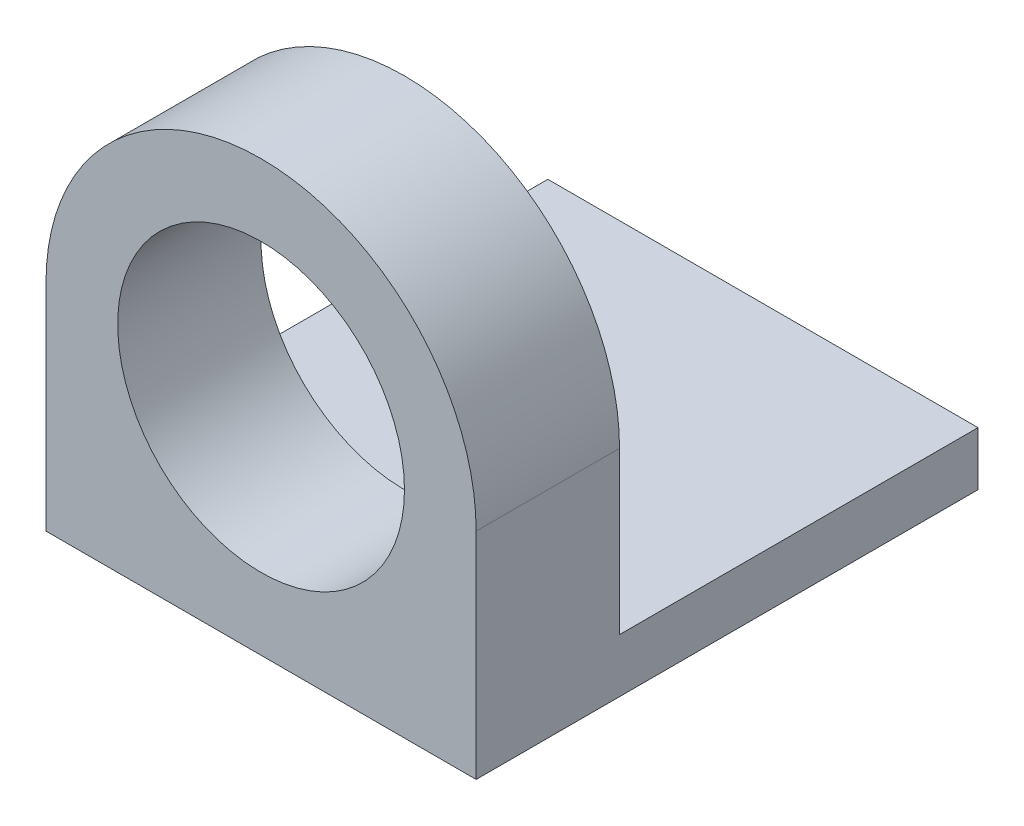
from build123d import *

# Parameters (mm, degrees)
SKETCH1_R           = 4
BOSS_EXTRUDE1_DEPTH = 4
SKETCH2_W           = 12
SKETCH2_H           = 1.5
BOSS_EXTRUDE2_DEPTH = 10


with BuildPart() as part:
    # Sketch1 → Boss-Extrude1 (new body)
    with BuildSketch(Plane.XY):
        with BuildLine():
            Line((0, -6), (-6, -6))
            Line((-6, -6), (-6, 0))
            ThreePointArc((-6, 0), (0, 6), (6, 0))
            Line((6, 0), (6, -6))
            Line((6, -6), (0, -6))
        make_face()
        Circle(SKETCH1_R, mode=Mode.SUBTRACT)
    extrude(amount=BOSS_EXTRUDE1_DEPTH)

    # Sketch2 → Boss-Extrude2 (add)
    with BuildSketch(Plane(origin=(0, 0, 0), x_dir=(-1, 0, 0), z_dir=(0, 0, -1))):
        with Locations((0, -5.25)):
            Rectangle(SKETCH2_W, SKETCH2_H)
    extrude(amount=BOSS_EXTRUDE2_DEPTH)


solid = part.part
